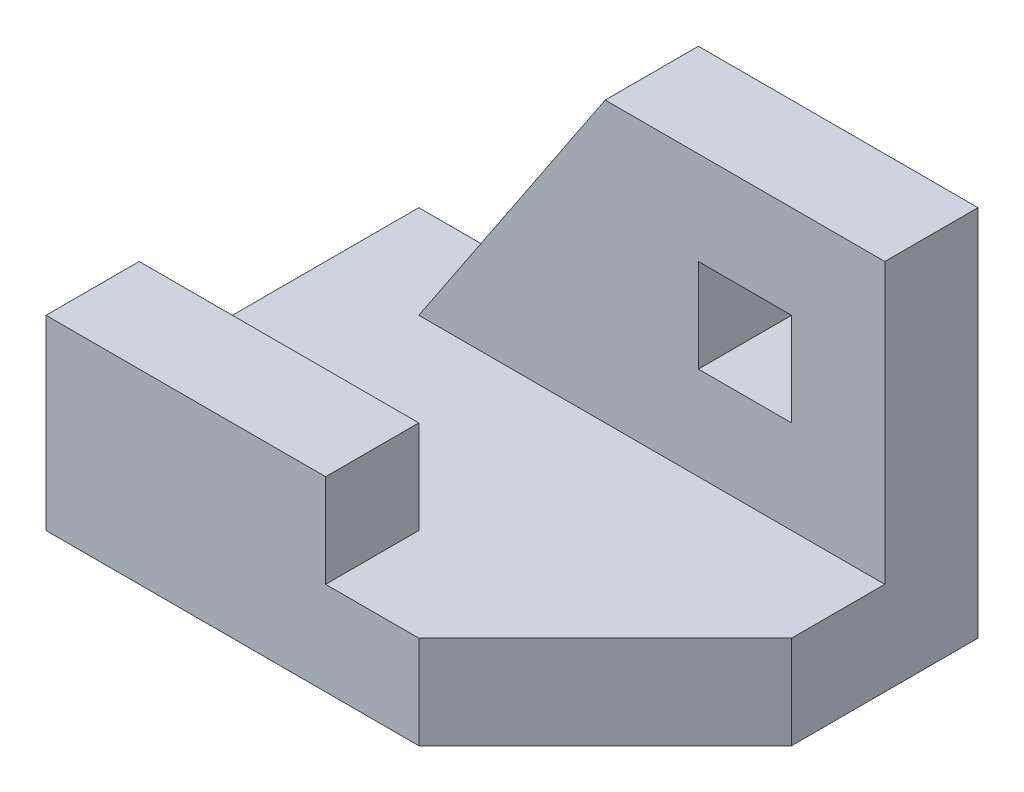
from build123d import *

# Parameters (mm, degrees)
SKETCH1_W           = 60
SKETCH1_H           = 40
BOSS_EXTRUDE1_DEPTH = 10
CHAMFER1_SIZE       = 20
SKETCH2_W           = 30
SKETCH2_H           = 10
BOSS_EXTRUDE2_DEPTH = 10
SKETCH3_W           = 10
SKETCH3_H           = 10
BOSS_EXTRUDE3_DEPTH = 10


with BuildPart() as part:
    # Sketch1 → Boss-Extrude1 (new body)
    with BuildSketch(Plane(origin=(0, 0, 0), x_dir=(1, 0, 0), z_dir=(0, 1, 0))):
        Rectangle(SKETCH1_W, SKETCH1_H)
    extrude(amount=BOSS_EXTRUDE1_DEPTH)

    # Chamfer1
    chamfer1_edges = [part.edges().sort_by_distance(p)[0] for p in [
        (30, 5, 20),
    ]]
    chamfer(chamfer1_edges, length=CHAMFER1_SIZE)

    # Sketch2 → Boss-Extrude2 (add)
    with BuildSketch(Plane(origin=(0, 10, 0), x_dir=(1, 0, 0), z_dir=(0, 1, 0))):
        with Locations((-15, -15)):
            Rectangle(SKETCH2_W, SKETCH2_H)
    extrude(amount=BOSS_EXTRUDE2_DEPTH)

    # Sketch3 → Boss-Extrude3 (add)
    with BuildSketch(Plane(origin=(0, 0, -20), x_dir=(-1, 0, 0), z_dir=(0, 0, -1))):
        Polygon((-30, 10), (-30, 40), (0, 40), (20, 10), align=None)
        with Locations((-15, 25)):
            Rectangle(SKETCH3_W, SKETCH3_H, mode=Mode.SUBTRACT)
    extrude(amount=-BOSS_EXTRUDE3_DEPTH)


solid = part.part
